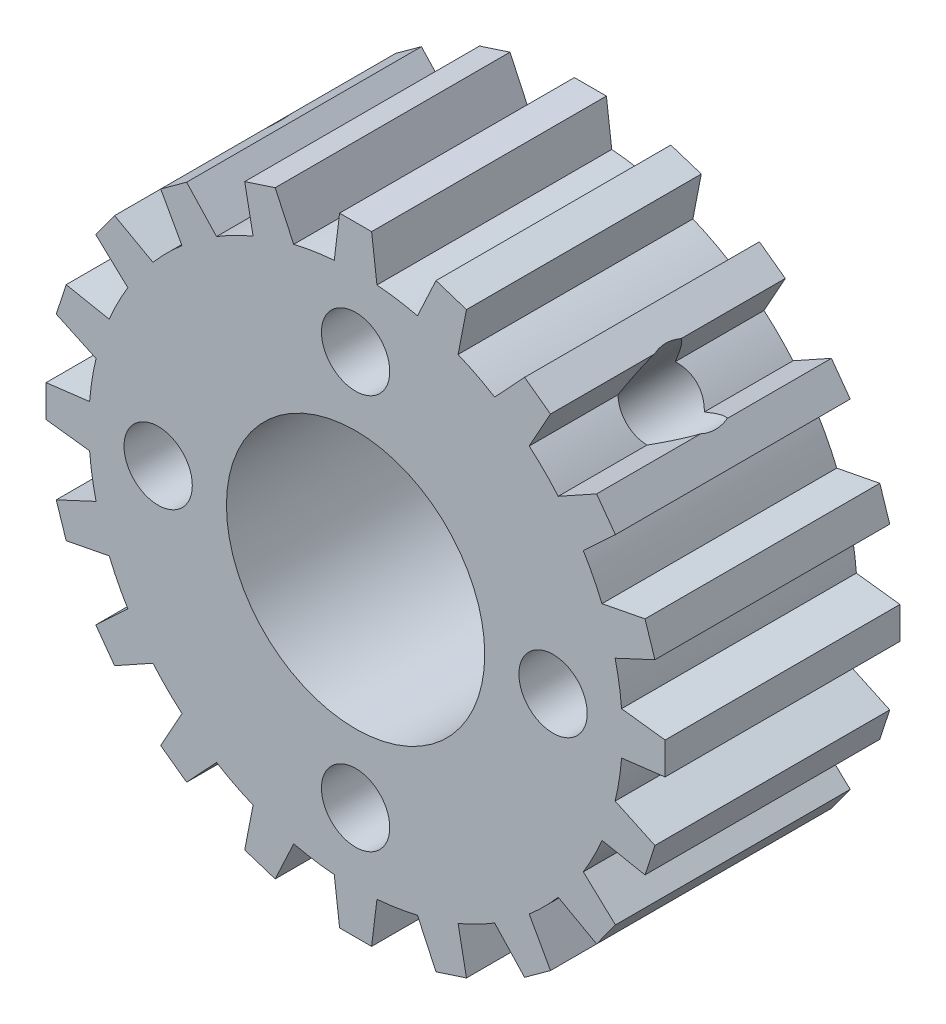
from build123d import *

# Parameters (mm, degrees)
SKETCH_1_R          = 1.6
SKETCH_1_R_2        = 6.05
EXTRUDE_1_DEPTH     = 11
SKETCH_2_R          = 1.65
CUT_EXTRUDE_3_DEPTH = 24.270152556
SKETCH_3_R          = 1.65
CUT_EXTRUDE_4_DEPTH = 24.270152604


with BuildPart() as part:
    # ｽｹｯﾁ1 → ﾎﾞｽ - 押し出し1 (new body)
    with BuildSketch(Plane.XY):
        with BuildLine():
            Line((1, 12.459935794), (0.75, 14.5))
            Line((0.75, 14.5), (-0.75, 14.5))
            Line((-0.75, 14.5), (-1, 12.459935794))
            ThreePointArc((-1, 12.459935794), (-1.955430813, 12.346104257), (-2.899275393, 12.159120124))
            Line((-2.899275393, 12.159120124), (-3.767454031, 14.022082232))
            Line((-3.767454031, 14.022082232), (-5.194038806, 13.55855674))
            Line((-5.194038806, 13.55855674), (-4.801388426, 11.541086135))
            ThreePointArc((-4.801388426, 11.541086135), (-5.674881247, 11.137581552), (-6.51474951, 10.668085059))
            Line((-6.51474951, 10.668085059), (-7.916123412, 12.171585358))
            Line((-7.916123412, 12.171585358), (-9.129648904, 11.289907479))
            Line((-9.129648904, 11.289907479), (-8.132783499, 9.492514554))
            ThreePointArc((-8.132783499, 9.492514554), (-8.838834765, 8.838834765), (-9.492514554, 8.132783499))
            Line((-9.492514554, 8.132783499), (-11.289907479, 9.129648904))
            Line((-11.289907479, 9.129648904), (-12.171585358, 7.916123412))
            Line((-12.171585358, 7.916123412), (-10.668085059, 6.51474951))
            ThreePointArc((-10.668085059, 6.51474951), (-11.137581552, 5.674881247), (-11.541086135, 4.801388426))
            Line((-11.541086135, 4.801388426), (-13.55855674, 5.194038806))
            Line((-13.55855674, 5.194038806), (-14.022082232, 3.767454031))
            Line((-14.022082232, 3.767454031), (-12.159120124, 2.899275393))
            ThreePointArc((-12.159120124, 2.899275393), (-12.346104257, 1.955430813), (-12.459935794, 1))
            Line((-12.459935794, 1), (-14.5, 0.75))
            Line((-14.5, 0.75), (-14.5, -0.75))
            Line((-14.5, -0.75), (-12.459935794, -1))
            ThreePointArc((-12.459935794, -1), (-12.346104257, -1.955430813), (-12.159120124, -2.899275393))
            Line((-12.159120124, -2.899275393), (-14.022082232, -3.767454031))
            Line((-14.022082232, -3.767454031), (-13.55855674, -5.194038806))
            Line((-13.55855674, -5.194038806), (-11.541086135, -4.801388426))
            ThreePointArc((-11.541086135, -4.801388426), (-11.137581552, -5.674881247), (-10.668085059, -6.51474951))
            Line((-10.668085059, -6.51474951), (-12.171585358, -7.916123412))
            Line((-12.171585358, -7.916123412), (-11.289907479, -9.129648904))
            Line((-11.289907479, -9.129648904), (-9.492514554, -8.132783499))
            ThreePointArc((-9.492514554, -8.132783499), (-8.838834765, -8.838834765), (-8.132783499, -9.492514554))
            Line((-8.132783499, -9.492514554), (-9.129648904, -11.289907479))
            Line((-9.129648904, -11.289907479), (-7.916123412, -12.171585358))
            Line((-7.916123412, -12.171585358), (-6.51474951, -10.668085059))
            ThreePointArc((-6.51474951, -10.668085059), (-5.674881247, -11.137581552), (-4.801388426, -11.541086135))
            Line((-4.801388426, -11.541086135), (-5.194038806, -13.55855674))
            Line((-5.194038806, -13.55855674), (-3.767454031, -14.022082232))
            Line((-3.767454031, -14.022082232), (-2.899275393, -12.159120124))
            ThreePointArc((-2.899275393, -12.159120124), (-1.955430813, -12.346104257), (-1, -12.459935794))
            Line((-1, -12.459935794), (-0.75, -14.5))
            Line((-0.75, -14.5), (0.75, -14.5))
            Line((0.75, -14.5), (1, -12.459935794))
            ThreePointArc((1, -12.459935794), (1.955430813, -12.346104257), (2.899275393, -12.159120124))
            Line((2.899275393, -12.159120124), (3.767454031, -14.022082232))
            Line((3.767454031, -14.022082232), (5.194038806, -13.55855674))
            Line((5.194038806, -13.55855674), (4.801388426, -11.541086135))
            ThreePointArc((4.801388426, -11.541086135), (5.674881247, -11.137581552), (6.51474951, -10.668085059))
            Line((6.51474951, -10.668085059), (7.916123412, -12.171585358))
            Line((7.916123412, -12.171585358), (9.129648904, -11.289907479))
            Line((9.129648904, -11.289907479), (8.132783499, -9.492514554))
            ThreePointArc((8.132783499, -9.492514554), (8.838834765, -8.838834765), (9.492514554, -8.132783499))
            Line((9.492514554, -8.132783499), (11.289907479, -9.129648904))
            Line((11.289907479, -9.129648904), (12.171585358, -7.916123412))
            Line((12.171585358, -7.916123412), (10.668085059, -6.51474951))
            ThreePointArc((10.668085059, -6.51474951), (11.137581552, -5.674881247), (11.541086135, -4.801388426))
            Line((11.541086135, -4.801388426), (13.558556741, -5.194038806))
            Line((13.558556741, -5.194038806), (14.022082232, -3.767454031))
            Line((14.022082232, -3.767454031), (12.159120124, -2.899275393))
            ThreePointArc((12.159120124, -2.899275393), (12.346104257, -1.955430813), (12.459935794, -1))
            Line((12.459935794, -1), (14.5, -0.75))
            Line((14.5, -0.75), (14.5, 0.75))
            Line((14.5, 0.75), (12.459935794, 1))
            ThreePointArc((12.459935794, 1), (12.346104257, 1.955430813), (12.159120124, 2.899275393))
            Line((12.159120124, 2.899275393), (14.022082232, 3.767454031))
            Line((14.022082232, 3.767454031), (13.55855674, 5.194038806))
            Line((13.55855674, 5.194038806), (11.541086135, 4.801388426))
            ThreePointArc((11.541086135, 4.801388426), (11.137581552, 5.674881247), (10.668085059, 6.51474951))
            Line((10.668085059, 6.51474951), (12.171585358, 7.916123412))
            Line((12.171585358, 7.916123412), (11.289907479, 9.129648904))
            Line((11.289907479, 9.129648904), (9.492514554, 8.132783499))
            ThreePointArc((9.492514554, 8.132783499), (8.838834765, 8.838834765), (8.132783499, 9.492514554))
            Line((8.132783499, 9.492514554), (9.129648904, 11.289907479))
            Line((9.129648904, 11.289907479), (7.916123412, 12.171585358))
            Line((7.916123412, 12.171585358), (6.51474951, 10.668085059))
            ThreePointArc((6.51474951, 10.668085059), (5.674881247, 11.137581552), (4.801388426, 11.541086135))
            Line((4.801388426, 11.541086135), (5.194038806, 13.55855674))
            Line((5.194038806, 13.55855674), (3.767454031, 14.022082232))
            Line((3.767454031, 14.022082232), (2.899275393, 12.159120124))
            ThreePointArc((2.899275393, 12.159120124), (1.955430813, 12.346104257), (1, 12.459935794))
        make_face()
        with Locations((-9.25, 0)):
            Circle(SKETCH_1_R, mode=Mode.SUBTRACT)
        with Locations((0, -9.25)):
            Circle(SKETCH_1_R, mode=Mode.SUBTRACT)
        Circle(SKETCH_1_R_2, mode=Mode.SUBTRACT)
        with Locations((9.25, 0)):
            Circle(SKETCH_1_R, mode=Mode.SUBTRACT)
        with Locations((0, 9.25)):
            Circle(SKETCH_1_R, mode=Mode.SUBTRACT)
    extrude(amount=EXTRUDE_1_DEPTH)

    # ｽｹｯﾁ2 → ｶｯﾄ - 押し出し3 (cut, through all)
    with BuildSketch(Plane(origin=(0, 0, 0), x_dir=(0, 0, -1), z_dir=(0.7071067811865464, -0.7071067811865488, 0))):
        with Locations(Location((-5.5, 0, 0), (0, 0, 90))):
            Circle(SKETCH_2_R)
    extrude(amount=-CUT_EXTRUDE_3_DEPTH, mode=Mode.SUBTRACT)

    # ｽｹｯﾁ3 → ｶｯﾄ - 押し出し4 (cut, through all)
    with BuildSketch(Plane(origin=(0, 0, 0), x_dir=(0, 0, -1), z_dir=(-0.7071067811865512, -0.7071067811865439, 0))):
        with Locations(Location((-5.5, 0, 0), (0, 0, 90))):
            Circle(SKETCH_3_R)
    extrude(amount=-CUT_EXTRUDE_4_DEPTH, mode=Mode.SUBTRACT)


solid = part.part
